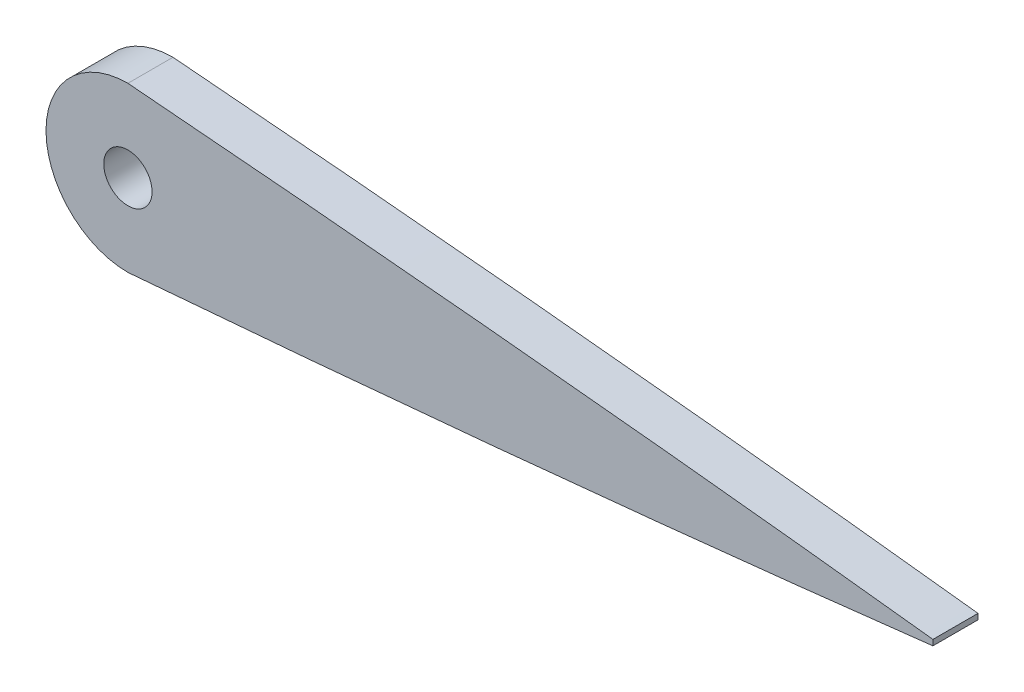
from build123d import *

# Parameters (mm, degrees)
SKETCH_1_R      = 1.5
EXTRUDE_1_DEPTH = 1.4


with BuildPart() as part:
    # Эскиз1 → Бобышка-Вытянуть1 (new, symmetric)
    with BuildSketch(Plane.XY):
        with BuildLine():
            Line((200, -0.17472), (200, 0.17472))
            add(Edge.make_bspline(
                [(200, 0.17472), (199.600682765, 0.221288408), (198.485364747, 0.351356884), (196.461970705, 0.583806064), (193.785612886, 0.886133118), (190.657944971, 1.231938396), (187.176422045, 1.607822673), (183.406732336, 2.004490231), (179.398353357, 2.414941802), (173.685417785, 2.983325928), (167.76840734, 3.545499789), (161.683149627, 4.096290968), (156.969182151, 4.508276909), (153.064759225, 4.837015276), (150.733840137, 5.027649351), (150, 5.087100899)],
                knots=[0, 0, 0, 0, 0.007144724, 0.019955661, 0.036196061, 0.055011184, 0.075878938, 0.098428866, 0.122375554, 0.147487886, 0.200459747, 0.22800517, 0.256076454, 0.284555151, 0.297639613, 0.297639613, 0.297639613, 0.297639613], degree=3))
            ThreePointArc((150, 5.087100899), (144.91290042, 0), (150, -5.087100899))
            add(Edge.make_bspline(
                [(150, -5.087100899), (150.733840137, -5.027649351), (153.064759225, -4.837015276), (156.969182151, -4.508276909), (161.683149627, -4.096290968), (167.76840734, -3.545499789), (173.685417785, -2.983325928), (179.398353357, -2.414941802), (183.406732336, -2.004490231), (187.176422045, -1.607822673), (190.657944971, -1.231938396), (193.785612886, -0.886133118), (196.461970705, -0.583806064), (198.485364747, -0.351356884), (199.600682765, -0.221288408), (200, -0.17472)],
                knots=[0.702360387, 0.702360387, 0.702360387, 0.702360387, 0.715444849, 0.743923546, 0.77199483, 0.799540253, 0.852512114, 0.877624446, 0.901571134, 0.924121062, 0.944988816, 0.963803939, 0.980044339, 0.992855276, 1, 1, 1, 1], degree=3))
        make_face()
        with Locations((150.000001319, 0)):
            Circle(SKETCH_1_R, mode=Mode.SUBTRACT)
    extrude(amount=EXTRUDE_1_DEPTH, both=True)


solid = part.part
